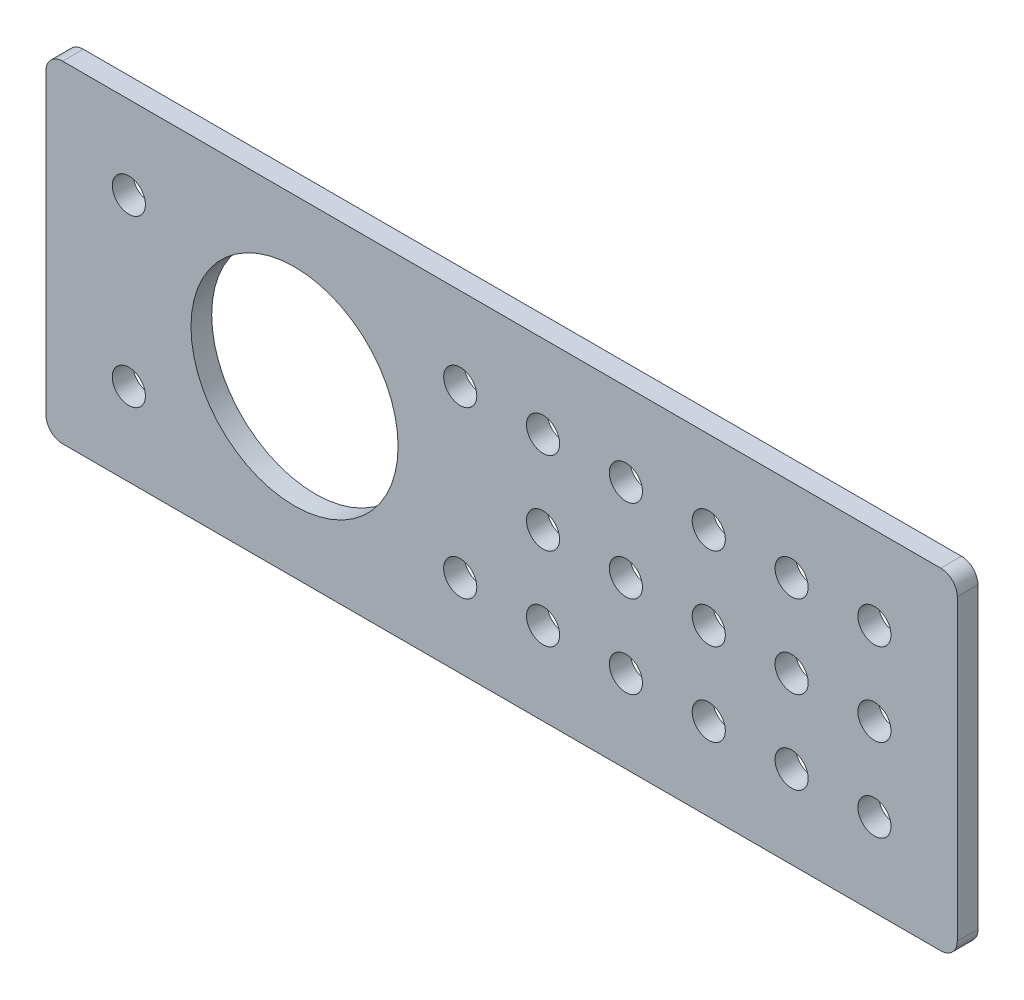
from build123d import *

# Parameters (mm, degrees)
SKETCH2_R           = 15.875
SKETCH2_R_2         = 2.54
BOSS_EXTRUDE1_DEPTH = 3.175
FILLET1_R           = 2.54


with BuildPart() as part:
    # Sketch2 → Boss-Extrude1 (new body)
    with BuildSketch(Plane.XY):
        Polygon((-508, 25.4), (-481.624580264, 25.4), (-457.99375, 25.4), (-431.8, 25.4), (-368.3, 25.4), (-368.3, -25.4), (-431.8, -25.4), (-457.99375, -25.4), (-481.624580264, -25.4), (-508, -25.4), align=None)
        with Locations((-469.9, 0)):
            Circle(SKETCH2_R, mode=Mode.SUBTRACT)
        with Locations((-495.3, 12.7)):
            Circle(SKETCH2_R_2, mode=Mode.SUBTRACT)
        with Locations((-495.3, -12.7)):
            Circle(SKETCH2_R_2, mode=Mode.SUBTRACT)
        with Locations((-444.5, -12.7)):
            Circle(SKETCH2_R_2, mode=Mode.SUBTRACT)
        with Locations((-431.8, -12.7)):
            Circle(SKETCH2_R_2, mode=Mode.SUBTRACT)
        with Locations((-419.1, -12.7)):
            Circle(SKETCH2_R_2, mode=Mode.SUBTRACT)
        with Locations((-419.1, 0)):
            Circle(SKETCH2_R_2, mode=Mode.SUBTRACT)
        with Locations((-431.8, 0)):
            Circle(SKETCH2_R_2, mode=Mode.SUBTRACT)
        with Locations((-431.8, 12.7)):
            Circle(SKETCH2_R_2, mode=Mode.SUBTRACT)
        with Locations((-419.1, 12.7)):
            Circle(SKETCH2_R_2, mode=Mode.SUBTRACT)
        with Locations((-444.5, 12.7)):
            Circle(SKETCH2_R_2, mode=Mode.SUBTRACT)
        with Locations((-406.4, 12.7)):
            Circle(SKETCH2_R_2, mode=Mode.SUBTRACT)
        with Locations((-406.4, 0)):
            Circle(SKETCH2_R_2, mode=Mode.SUBTRACT)
        with Locations((-406.4, -12.7)):
            Circle(SKETCH2_R_2, mode=Mode.SUBTRACT)
        with Locations((-393.7, 12.7)):
            Circle(SKETCH2_R_2, mode=Mode.SUBTRACT)
        with Locations((-393.7, 0)):
            Circle(SKETCH2_R_2, mode=Mode.SUBTRACT)
        with Locations((-393.7, -12.7)):
            Circle(SKETCH2_R_2, mode=Mode.SUBTRACT)
        with Locations((-381, 12.7)):
            Circle(SKETCH2_R_2, mode=Mode.SUBTRACT)
        with Locations((-381, 0)):
            Circle(SKETCH2_R_2, mode=Mode.SUBTRACT)
        with Locations((-381, -12.7)):
            Circle(SKETCH2_R_2, mode=Mode.SUBTRACT)
    extrude(amount=BOSS_EXTRUDE1_DEPTH)

    # Fillet1
    fillet1_edges = [part.edges().sort_by_distance(p)[0] for p in [
        (-508, 25.4, 1.5875),
        (-368.3, 25.4, 1.5875),
        (-368.3, -25.4, 1.5875),
        (-508, -25.4, 1.5875),
    ]]
    fillet(fillet1_edges, radius=FILLET1_R)


solid = part.part
